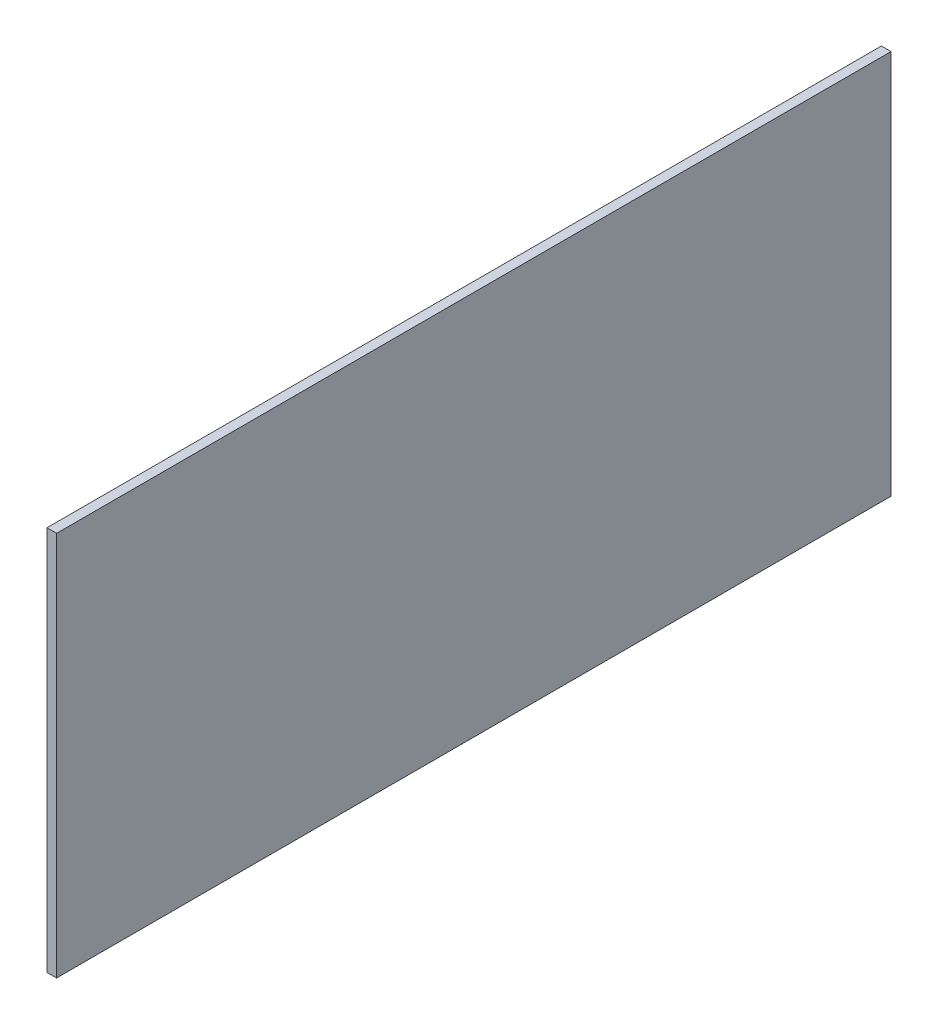
from build123d import *

# Parameters (mm, degrees)
SKETCH1_W           = 600
SKETCH1_H           = 1300
BOSS_EXTRUDE1_DEPTH = 15


with BuildPart() as part:
    # Sketch1 → Boss-Extrude1 (new body)
    with BuildSketch(Plane.YZ):
        Rectangle(SKETCH1_W, SKETCH1_H)
    extrude(amount=BOSS_EXTRUDE1_DEPTH)


solid = part.part
